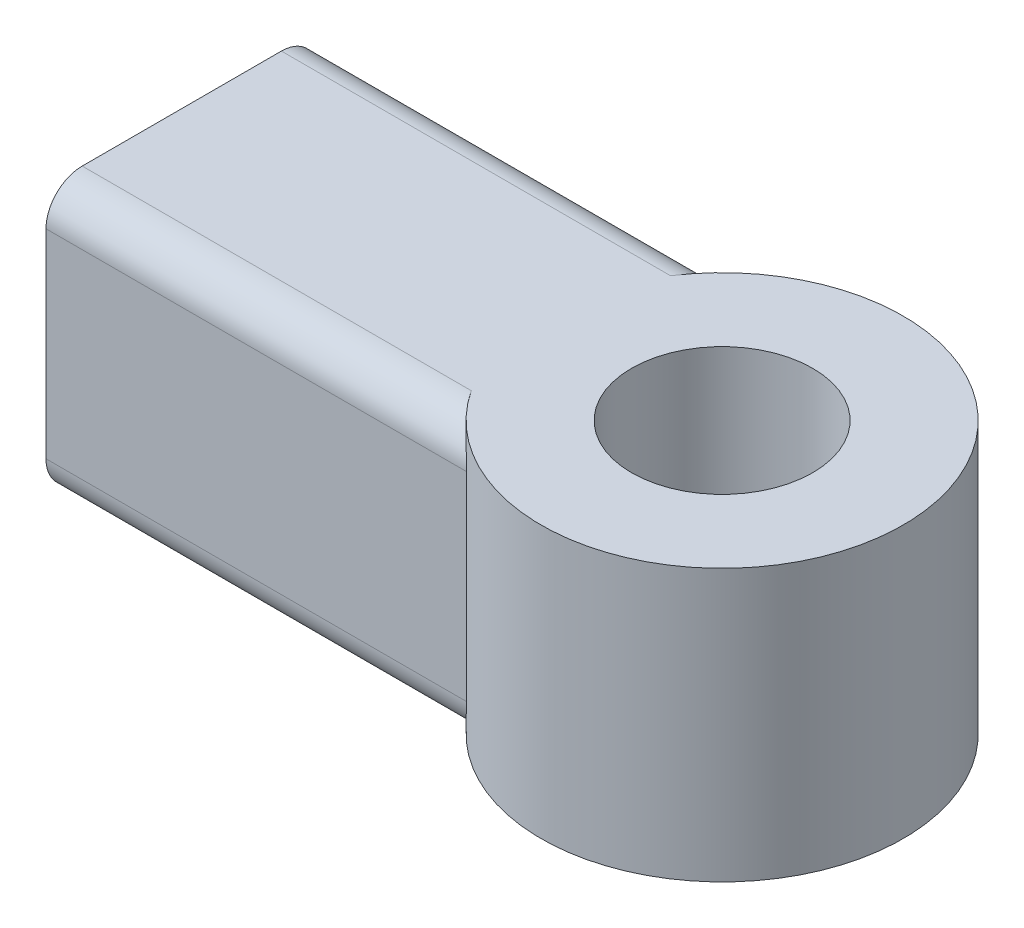
from build123d import *

# Parameters (mm, degrees)
SKETCH1_R           = 3.175
BOSS_EXTRUDE1_DEPTH = 9.525
FILLET1_R           = 1.27
SKETCH2_R           = 3.175
CUT_EXTRUDE1_DEPTH  = 12.7


with BuildPart() as part:
    # Sketch1 → Boss-Extrude1 (new body)
    with BuildSketch(Plane(origin=(0, 0, 0), x_dir=(1, 0, 0), z_dir=(0, 1, 0))):
        with BuildLine():
            Line((-4.200130206, -4.7625), (-18.948458917, -4.7625))
            Line((-18.948458917, -4.7625), (-18.948458917, 4.7625))
            Line((-18.948458917, 4.7625), (-4.200130206, 4.7625))
            ThreePointArc((-4.200130206, 4.7625), (6.35, 0), (-4.200130206, -4.7625))
        make_face()
        with Locations(Location((0, 0, 0), (0, 0, 90))):
            Circle(SKETCH1_R, mode=Mode.SUBTRACT)
    extrude(amount=BOSS_EXTRUDE1_DEPTH)

    # Fillet1
    fillet1_edges = [part.edges().sort_by_distance(p)[0] for p in [
        (-11.574294562, 9.525, -4.7625),
        (-11.574294562, 0, -4.7625),
        (-11.574294562, 0, 4.7625),
        (-11.574294562, 9.525, 4.7625),
    ]]
    fillet(fillet1_edges, radius=FILLET1_R)

    # Sketch2 → Cut-Extrude1 (cut)
    with BuildSketch(Plane.ZY.offset(18.948458917)):
        with Locations((0, 4.7625)):
            Circle(SKETCH2_R)
    extrude(amount=-CUT_EXTRUDE1_DEPTH, mode=Mode.SUBTRACT)


solid = part.part
